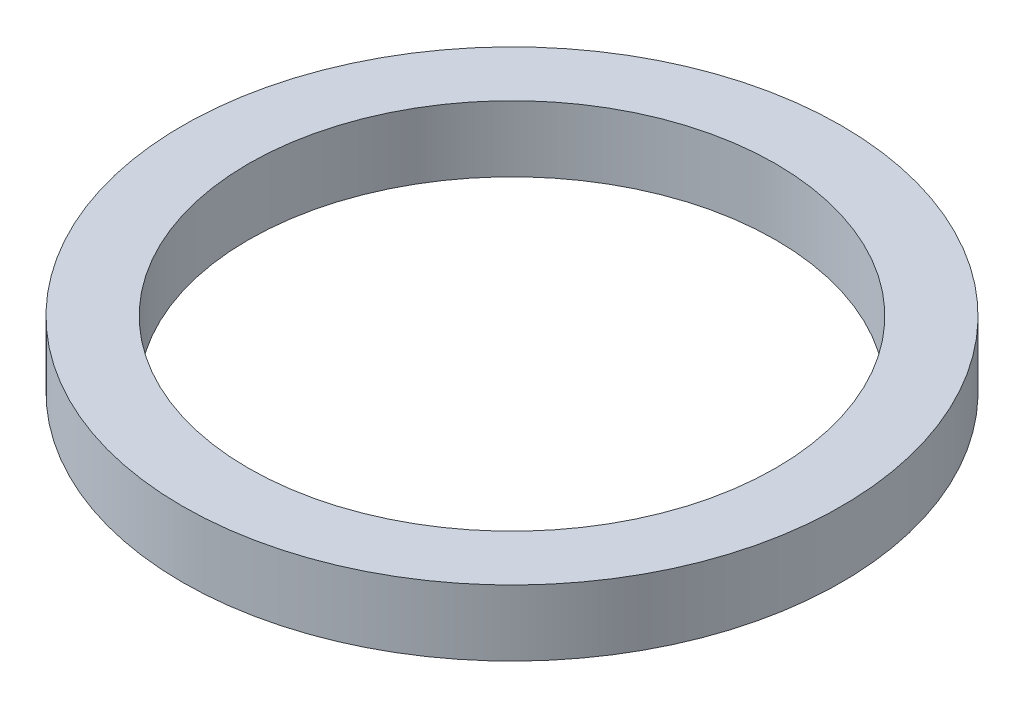
from build123d import *

# Parameters (mm, degrees)
SKETCH_1_W = 2
SKETCH_1_H = 2


with BuildPart() as part:
    # 草图1 → 旋转1 (revolve)
    with BuildSketch(Plane.XY):
        with Locations((1, -1)):
            Rectangle(SKETCH_1_W, SKETCH_1_H)
    revolve(axis=Axis((10, -3.284902411, 0), (0, 1, 0)))


solid = part.part
